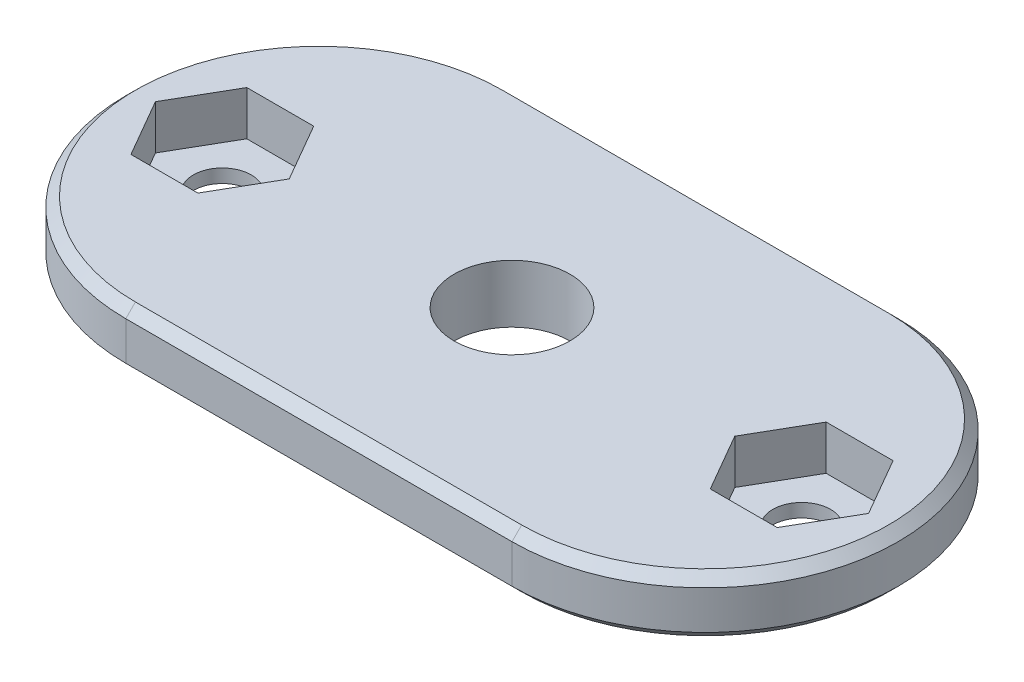
from build123d import *

# Parameters (mm, degrees)
BOSS_EXTRUDE1_DEPTH             = 3
M3X0_5_TAPPED_HOLE1_D           = 3
M3X0_5_TAPPED_HOLE1_CSINK_D     = 3.05
M3X0_5_TAPPED_HOLE1_CSINK_ANGLE = 90
CHAMFER1_SIZE                   = 0.5
SKETCH3_R                       = 3
CUT_EXTRUDE1_DEPTH              = 32.764760349
CUT_EXTRUDE2_DEPTH              = 2.3


with BuildPart() as part:
    # Sketch2 → Boss-Extrude1 (new body)
    with BuildSketch(Plane(origin=(0, 0, 0), x_dir=(1, 0, 0), z_dir=(0, 1, 0))):
        with BuildLine():
            Line((0, 10), (20, 10))
            ThreePointArc((20, 10), (30, 0), (20, -10))
            Line((20, -10), (0, -10))
            ThreePointArc((0, -10), (-10, 0), (0, 10))
        make_face()
    extrude(amount=BOSS_EXTRUDE1_DEPTH)

    # M3x0.5 Tapped Hole1 (through all)
    with Locations(Plane(origin=(0, 3, 0), x_dir=(1, 0, 0), z_dir=(0, 1, 0))):
        with Locations((-5, 0), (25, 0)):
            CounterSinkHole(M3X0_5_TAPPED_HOLE1_D / 2, M3X0_5_TAPPED_HOLE1_CSINK_D / 2, counter_sink_angle=M3X0_5_TAPPED_HOLE1_CSINK_ANGLE)

    # Chamfer1
    chamfer1_edges = [part.edges().sort_by_distance(p)[0] for p in [
        (30, 3, 0),
        (10, 3, -10),
        (-10, 3, 0),
        (10, 0, -10),
        (30, 0, 0),
        (10, 0, 10),
        (-10, 0, 0),
        (10, 3, 10),
    ]]
    chamfer(chamfer1_edges, length=CHAMFER1_SIZE)

    # Sketch3 → Cut-Extrude1 (cut, through all)
    with BuildSketch(Plane(origin=(0, 3, 0), x_dir=(1, 0, 0), z_dir=(0, 1, 0))):
        with Locations(Location((10, 0, 0), (0, 0, 270))):
            Circle(SKETCH3_R)
    extrude(amount=-CUT_EXTRUDE1_DEPTH, mode=Mode.SUBTRACT)

    # Sketch16 → Cut-Extrude2 (cut)
    with BuildSketch(Plane(origin=(0, 3, 0), x_dir=(1, 0, 0), z_dir=(0, 1, 0))):
        Polygon((-1.535898385, 0), (-3.267949192, 3), (-6.732050808, 3), (-8.464101615, 0), (-6.732050808, -3), (-3.267949192, -3), align=None)
        Polygon((21.535898385, 0), (23.267949192, -3), (26.732050808, -3), (28.464101615, 0), (26.732050808, 3), (23.267949192, 3), align=None)
    extrude(amount=-CUT_EXTRUDE2_DEPTH, mode=Mode.SUBTRACT)


solid = part.part
